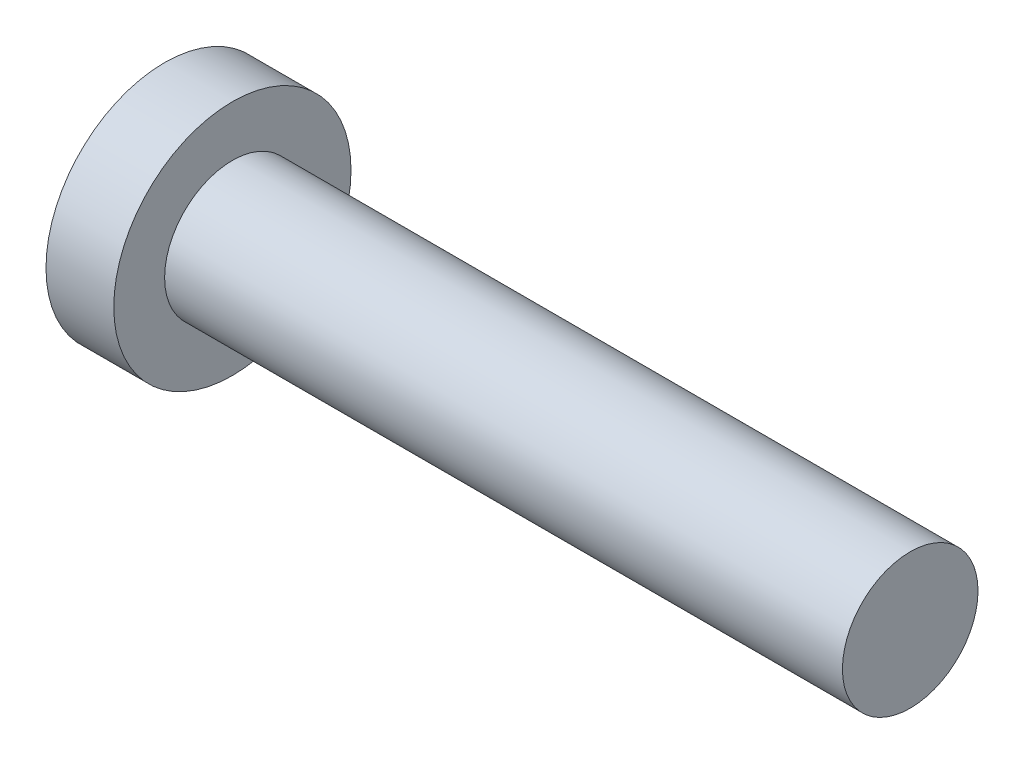
from build123d import *

# Parameters (mm, degrees)
SKETCH_1_R      = 1
EXTRUDE_1_DEPTH = 10
SKETCH_2_R      = 1.75
EXTRUDE_2_DEPTH = 1


with BuildPart() as part:
    # 草图1 → 凸台-拉伸1 (new body)
    with BuildSketch(Plane(origin=(0, 0, 0), x_dir=(0, 0, -1), z_dir=(1, 0, 0))):
        Circle(SKETCH_1_R)
    extrude(amount=EXTRUDE_1_DEPTH)

    # 草图2 → 凸台-拉伸2 (add)
    with BuildSketch(Plane.ZY):
        Circle(SKETCH_2_R)
    extrude(amount=EXTRUDE_2_DEPTH)


solid = part.part
